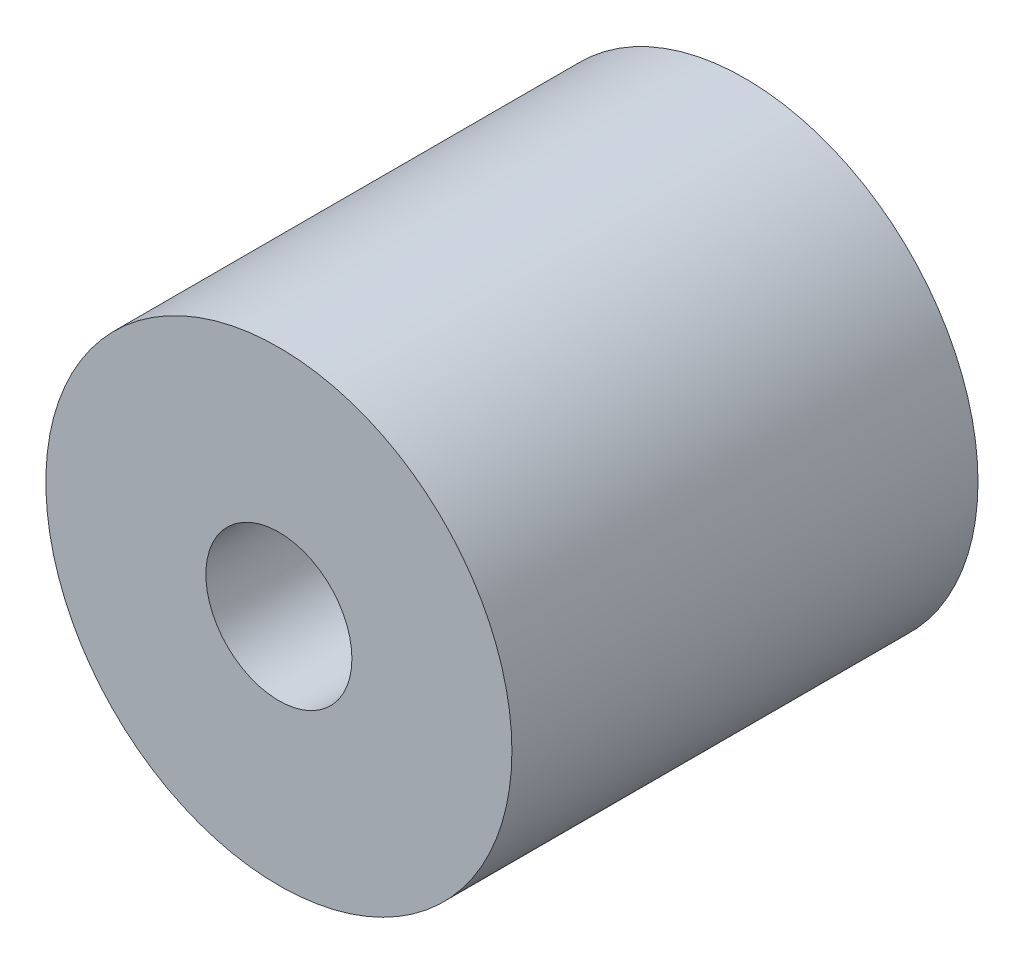
from build123d import *

# Parameters (mm, degrees)
SCHIZZO1_R                   = 7.5
SCHIZZO1_R_2                 = 2.5
ESTRUSIONE_ESTRUSIONE1_DEPTH = 15
ESTRUSIONE_ESTRUSIONE2_DEPTH = 6
ESTRUSIONE_ESTRUSIONE3_START = -9
SCHIZZO3_R                   = 2.5
SCHIZZO3_R_2                 = 2.35
ESTRUSIONE_ESTRUSIONE3_DEPTH = 9


with BuildPart() as part:
    # Schizzo1 → Estrusione-Estrusione1 (new body)
    with BuildSketch(Plane.XY):
        Circle(SCHIZZO1_R)
        Circle(SCHIZZO1_R_2, mode=Mode.SUBTRACT)
    extrude(amount=ESTRUSIONE_ESTRUSIONE1_DEPTH)

    # Schizzo2 → Estrusione-Estrusione2 (add)
    with BuildSketch(Plane(origin=(0, 0, 0), x_dir=(-1, 0, 0), z_dir=(0, 0, -1))):
        with BuildLine():
            Line((-2, -1.5), (2, -1.5))
            ThreePointArc((2, -1.5), (0, -2.5), (-2, -1.5))
        make_face()
        with BuildLine():
            Line((-2, 1.5), (2, 1.5))
            ThreePointArc((2, 1.5), (0, 2.5), (-2, 1.5))
        make_face()
    extrude(amount=-ESTRUSIONE_ESTRUSIONE2_DEPTH)

    # Schizzo3 → Estrusione-Estrusione3 (add)
    with BuildSketch(Plane.XY.offset(15).offset(ESTRUSIONE_ESTRUSIONE3_START)):
        Circle(SCHIZZO3_R)
        Circle(SCHIZZO3_R_2, mode=Mode.SUBTRACT)
    extrude(amount=ESTRUSIONE_ESTRUSIONE3_DEPTH)


solid = part.part
